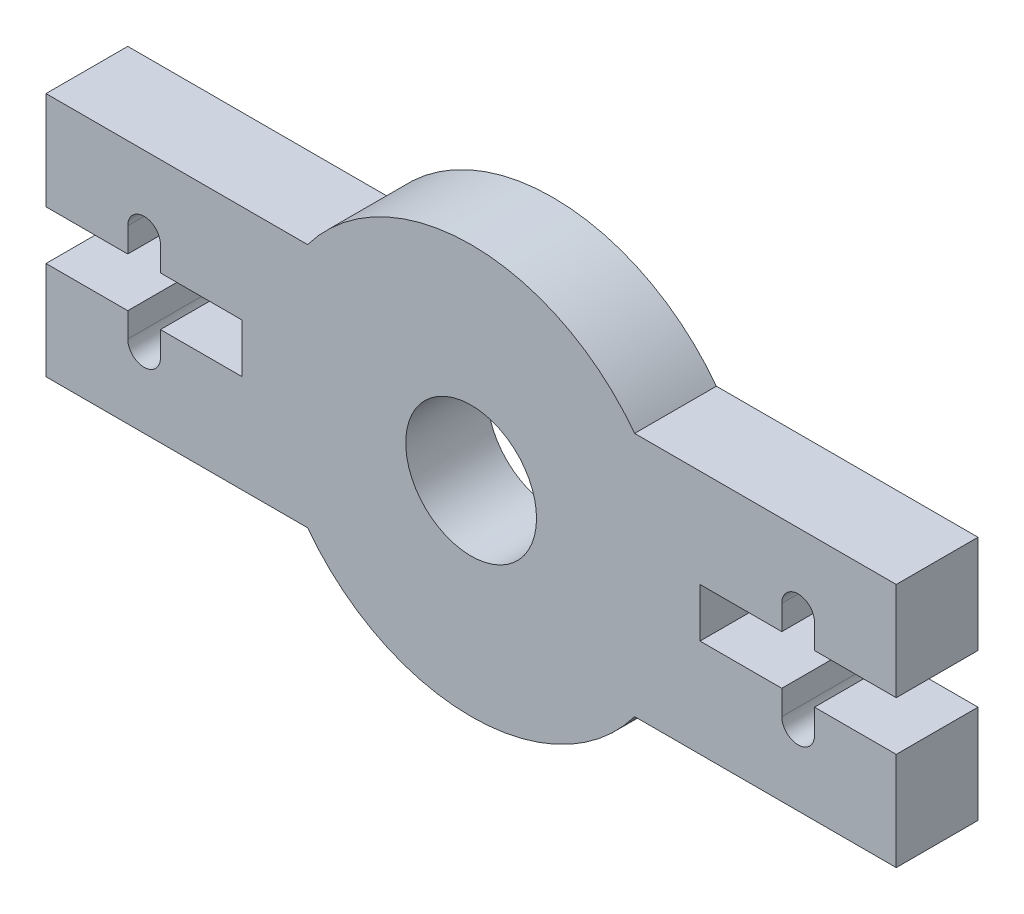
from build123d import *

# Parameters (mm, degrees)
BOSS_EXTRUDE1_DEPTH = 5
SKETCH2_R           = 4
CUT_EXTRUDE1_DEPTH  = 5


with BuildPart() as part:
    # Sketch1 → Boss-Extrude1 (new body)
    with BuildSketch(Plane.XY):
        with BuildLine():
            Line((-10, -7.5), (10, -7.5))
            ThreePointArc((10, -7.5), (11.858541226, -3.952847075), (12.5, 0))
            ThreePointArc((12.5, 0), (11.858541226, 3.952847075), (10, 7.5))
            Line((10, 7.5), (-10, 7.5))
            ThreePointArc((-10, 7.5), (-12.5, 0), (-10, -7.5))
        make_face()
        with BuildLine():
            ThreePointArc((10, 7.5), (0, 12.5), (-10, 7.5))
            Line((-10, 7.5), (10, 7.5))
        make_face()
        with BuildLine():
            ThreePointArc((-10, -7.5), (0, -12.5), (10, -7.5))
            Line((10, -7.5), (-10, -7.5))
        make_face()
        with BuildLine():
            Line((-26, -7.5), (-10, -7.5))
            ThreePointArc((-10, -7.5), (-12.5, 0), (-10, 7.5))
            Line((-10, 7.5), (-26, 7.5))
            Line((-26, 7.5), (-26, 1.5))
            Line((-26, 1.5), (-21, 1.5))
            Line((-21, 1.5), (-21, 3))
            ThreePointArc((-21, 3), (-20, 4), (-19, 3))
            Line((-19, 3), (-19, 1.5))
            Line((-19, 1.5), (-14, 1.5))
            Line((-14, 1.5), (-14, -1.5))
            Line((-14, -1.5), (-19, -1.5))
            Line((-19, -1.5), (-19, -3))
            ThreePointArc((-19, -3), (-20, -4), (-21, -3))
            Line((-21, -3), (-21, -1.5))
            Line((-21, -1.5), (-26, -1.5))
            Line((-26, -1.5), (-26, -7.5))
        make_face()
        with BuildLine():
            Line((10, -7.5), (26, -7.5))
            Line((26, -7.5), (26, -1.5))
            Line((26, -1.5), (21, -1.5))
            Line((21, -1.5), (21, -3))
            ThreePointArc((21, -3), (20, -4), (19, -3))
            Line((19, -3), (19, -1.5))
            Line((19, -1.5), (14, -1.5))
            Line((14, -1.5), (14, 1.5))
            Line((14, 1.5), (19, 1.5))
            Line((19, 1.5), (19, 3))
            ThreePointArc((19, 3), (20, 4), (21, 3))
            Line((21, 3), (21, 1.5))
            Line((21, 1.5), (26, 1.5))
            Line((26, 1.5), (26, 7.5))
            Line((26, 7.5), (10, 7.5))
            ThreePointArc((10, 7.5), (11.858541226, 3.952847075), (12.5, 0))
            ThreePointArc((12.5, 0), (11.858541226, -3.952847075), (10, -7.5))
        make_face()
    extrude(amount=BOSS_EXTRUDE1_DEPTH)

    # Sketch2 → Cut-Extrude1 (cut)
    with BuildSketch(Plane.XY.offset(5)):
        Circle(SKETCH2_R)
    extrude(amount=-CUT_EXTRUDE1_DEPTH, mode=Mode.SUBTRACT)


solid = part.part
